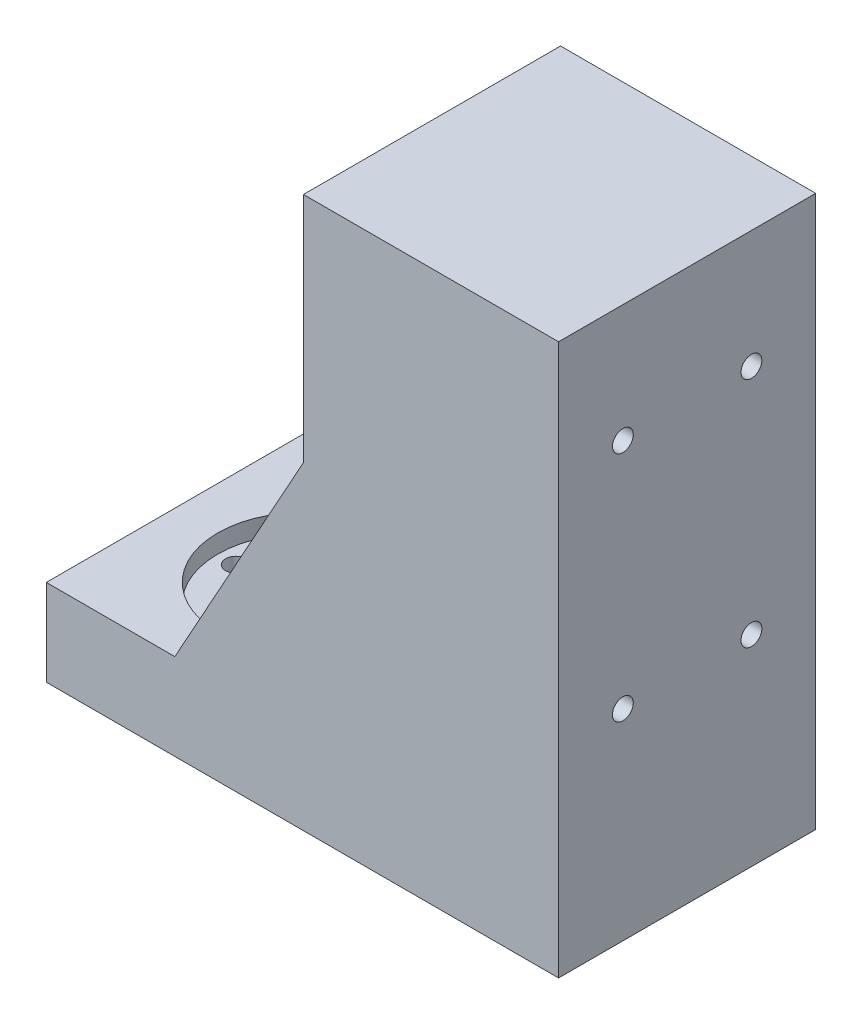
from build123d import *

# Parameters (mm, degrees)
BOSS_EXTRUDE1_DEPTH = 42
SKETCH3_R           = 3
CUT_EXTRUDE1_DEPTH  = 14.120795661
SKETCH4_R           = 14
CUT_EXTRUDE3_DEPTH  = 3
SKETCH5_R           = 9
CUT_EXTRUDE4_DEPTH  = 5
SKETCH6_R           = 1.7
CUT_EXTRUDE5_DEPTH  = 11.41
SKETCH7_R           = 1.7
CUT_EXTRUDE6_DEPTH  = 41.679003175
BOSS_EXTRUDE2_DEPTH = 2
BOSS_EXTRUDE3_DEPTH = 2


with BuildPart() as part:
    # Sketch1 → Boss-Extrude1 (new body)
    with BuildSketch(Plane.XY):
        Polygon((0, 0), (42, 0), (42, 75.879204339), (83.679003175, 75.879204339), (83.679003175, -14.120795661), (42, -14.120795661), (0, -14.120795661), align=None)
    extrude(amount=BOSS_EXTRUDE1_DEPTH)

    # Sketch3 → Cut-Extrude1 (cut)
    with BuildSketch(Plane(origin=(0, 0, 0), x_dir=(1, 0, 0), z_dir=(0, 1, 0))):
        with Locations(Location((21, -21, 0), (0, 0, 270))):
            Circle(SKETCH3_R)
    extrude(amount=-CUT_EXTRUDE1_DEPTH, mode=Mode.SUBTRACT)

    # Sketch4 → Cut-Extrude3 (cut)
    with BuildSketch(Plane(origin=(0, 0, 0), x_dir=(1, 0, 0), z_dir=(0, 1, 0))):
        with Locations(Location((21, -21, 0), (0, 0, 270))):
            Circle(SKETCH4_R)
    extrude(amount=-CUT_EXTRUDE3_DEPTH, mode=Mode.SUBTRACT)

    # Sketch5 → Cut-Extrude4 (cut)
    with BuildSketch(Plane(origin=(0, 0, 0), x_dir=(1, 0, 0), z_dir=(0, 1, 0))):
        with Locations(Location((21, -21, 0), (0, 0, 270))):
            Circle(SKETCH5_R)
    extrude(amount=-CUT_EXTRUDE4_DEPTH, mode=Mode.SUBTRACT)

    # Sketch6 → Cut-Extrude5 (cut)
    with BuildSketch(Plane(origin=(0, -3, 0), x_dir=(1, 0, 0), z_dir=(0, 1, 0))):
        with Locations(Location((21, -10, 0), (0, 0, 270))):
            Circle(SKETCH6_R)
        with Locations(Location((32, -21, 0), (0, 0, 270))):
            Circle(SKETCH6_R)
        with Locations(Location((21, -32, 0), (0, 0, 270))):
            Circle(SKETCH6_R)
        with Locations(Location((10, -21, 0), (0, 0, 270))):
            Circle(SKETCH6_R)
    extrude(amount=-CUT_EXTRUDE5_DEPTH, mode=Mode.SUBTRACT)

    # Sketch7 → Cut-Extrude6 (cut)
    with BuildSketch(Plane.ZY.offset(-42)):
        with Locations((10.5, 56.654204339)):
            Circle(SKETCH7_R)
        with Locations((31.5, 56.654204339)):
            Circle(SKETCH7_R)
        with Locations((10.5, 18.71460217)):
            Circle(SKETCH7_R)
        with Locations((31.5, 18.71460217)):
            Circle(SKETCH7_R)
    extrude(amount=-CUT_EXTRUDE6_DEPTH, mode=Mode.SUBTRACT)

    # Sketch8 → Boss-Extrude2 (add)
    with BuildSketch(Plane.XY.offset(42)):
        Polygon((42, 37.93960217), (21, 0), (42, 0), align=None)
    extrude(amount=-BOSS_EXTRUDE2_DEPTH)

    # Sketch9 → Boss-Extrude3 (add)
    with BuildSketch(Plane(origin=(0, 0, 0), x_dir=(-1, 0, 0), z_dir=(0, 0, -1))):
        Polygon((-42, 37.93960217), (-21, 0), (-42, 0), align=None)
    extrude(amount=-BOSS_EXTRUDE3_DEPTH)


solid = part.part
